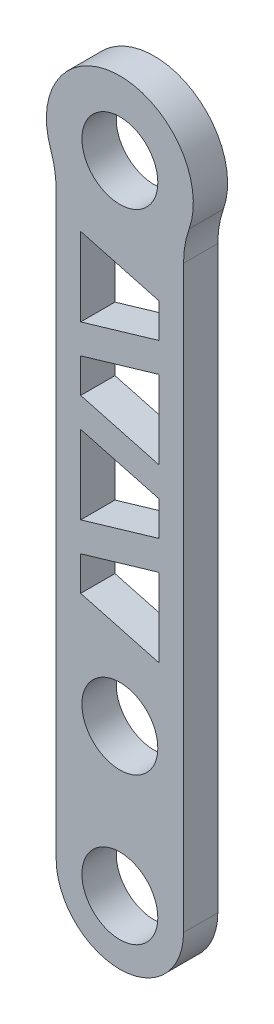
from build123d import *

# Parameters (mm, degrees)
SKETCH1_R           = 7.75
BOSS_EXTRUDE1_DEPTH = 7


with BuildPart() as part:
    # Sketch1 → Boss-Extrude1 (new body)
    with BuildSketch(Plane.XY):
        with BuildLine():
            Line((-14.121781939, 65.817369233), (-14.121781939, -52.520726978))
            ThreePointArc((-14.121781939, -52.520726978), (-1.121781939, -65.520726978), (11.878218061, -52.520726978))
            Line((11.878218061, -52.520726978), (11.878218061, 65.817369233))
            ThreePointArc((11.878218061, 65.817369233), (12.166002849, 69.197986251), (13.021075204, 72.481314255))
            ThreePointArc((13.021075204, 72.481314255), (-1.121781939, 92.479273022), (-15.264639082, 72.481314255))
            ThreePointArc((-15.264639082, 72.481314255), (-14.409566727, 69.197986251), (-14.121781939, 65.817369233))
        make_face()
        with Locations((-1.121781939, -52.520726978)):
            Circle(SKETCH1_R, mode=Mode.SUBTRACT)
        with Locations((-1.121781939, -22.520726978)):
            Circle(SKETCH1_R, mode=Mode.SUBTRACT)
        with Locations((-1.121781939, 77.479273022)):
            Circle(SKETCH1_R, mode=Mode.SUBTRACT)
        Polygon((-9.121781939, 3.957653989), (-9.121781939, -3.042346011), (6.878218061, -7.32953309), (6.878218061, 8.67046691), align=None, mode=Mode.SUBTRACT)
        Polygon((-9.121781939, 31.957653989), (6.878218061, 27.67046691), (6.878218061, 43.67046691), (-9.121781939, 38.957653989), align=None, mode=Mode.SUBTRACT)
        Polygon((6.878218061, 56.67046691), (-9.121781939, 60.957653989), (-9.121781939, 44.957653989), (6.878218061, 49.67046691), align=None, mode=Mode.SUBTRACT)
        Polygon((-9.121781939, 9.957653989), (6.878218061, 14.67046691), (6.878218061, 21.67046691), (-9.121781939, 25.957653989), align=None, mode=Mode.SUBTRACT)
    extrude(amount=BOSS_EXTRUDE1_DEPTH)


solid = part.part
